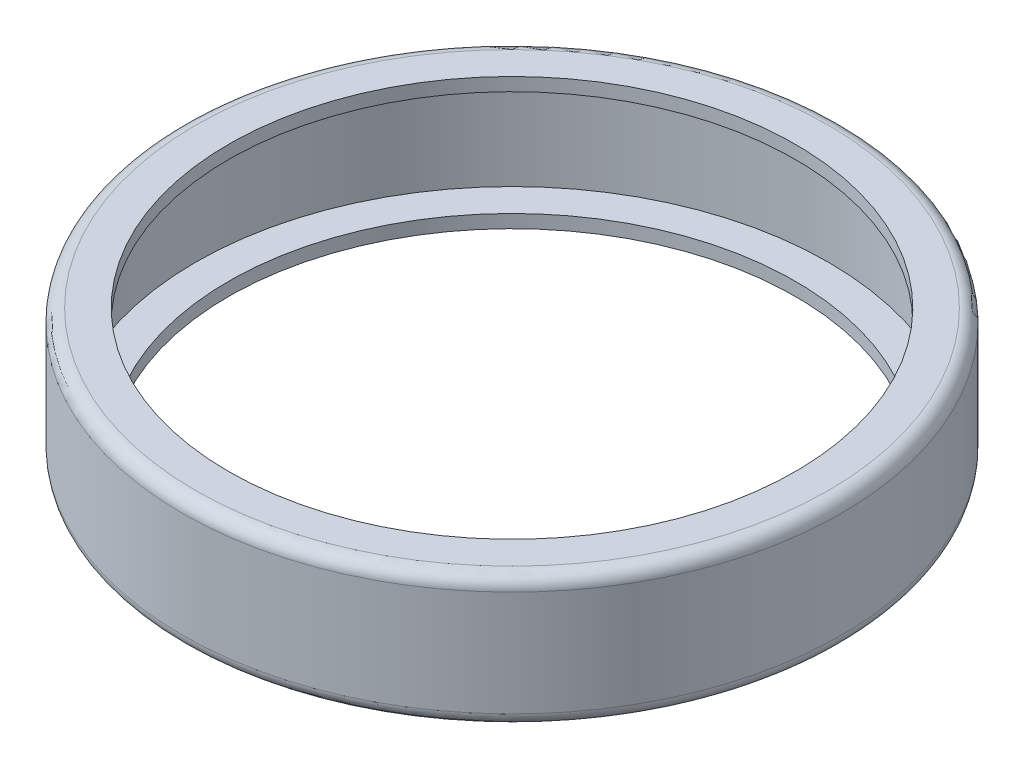
from build123d import *

# Parameters (mm, degrees)
FILLET1_R = 1


with BuildPart() as part:
    # Sketch1 → Revolve1 (revolve)
    with BuildSketch(Plane.XY, mode=Mode.PRIVATE) as revolve1_sk:
        Polygon((-21.5, 0), (-25, 0), (-25, 10), (-21.5, 10), (-21.5, 9), (-24, 9), (-24, 1), (-21.5, 1), align=None)
    revolve(revolve1_sk.sketch.rotate(Axis((0, 9.085123741, 0), (0, -1, 0)), 270), axis=Axis((0, 9.085123741, 0), (0, -1, 0)))

    # Fillet1
    fillet1_edges = [part.edges().sort_by_distance(p)[0] for p in [
        (0, 0, -25),
        (0, 10, -25),
    ]]
    fillet(fillet1_edges, radius=FILLET1_R)


solid = part.part
